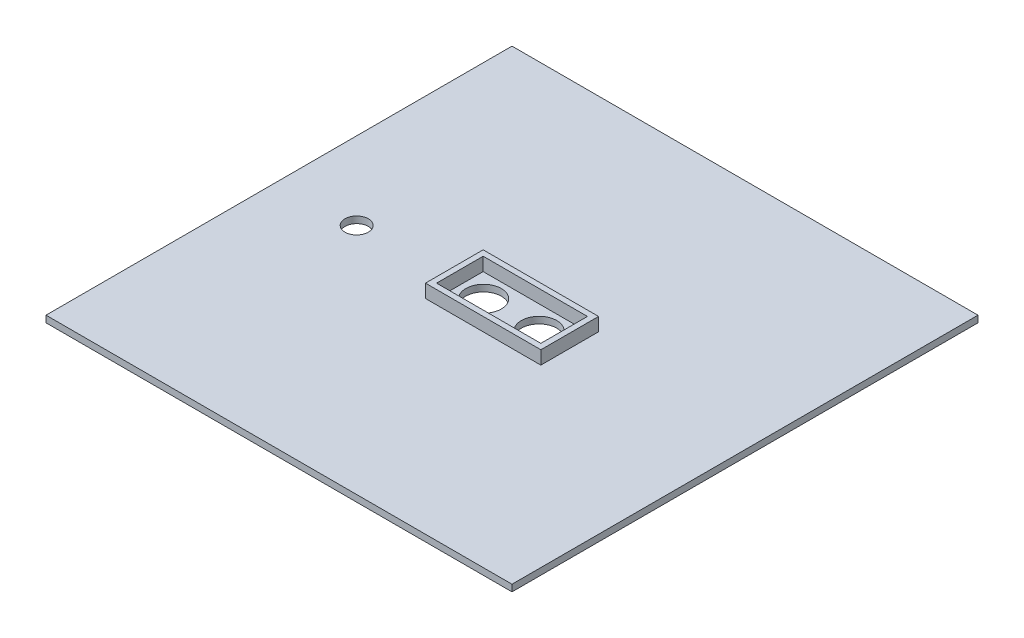
from build123d import *

# Parameters (mm, degrees)
SKETCH1_W           = 210
SKETCH1_H           = 210
BOSS_EXTRUDE1_DEPTH = 3
SKETCH2_W           = 199
SKETCH2_H           = 199
SKETCH2_W_2         = 193
SKETCH2_H_2         = 193
BOSS_EXTRUDE2_DEPTH = 5
SKETCH3_R           = 8
CUT_EXTRUDE1_DEPTH  = 149.707767114
SKETCH5_W           = 52
SKETCH5_H           = 26
SKETCH5_W_2         = 47
SKETCH5_H_2         = 21
BOSS_EXTRUDE4_DEPTH = 6
SKETCH8_W           = 10
SKETCH8_H           = 4
CUT_EXTRUDE2_DEPTH  = 149.707767114
SKETCH9_R           = 5.25
CUT_EXTRUDE3_DEPTH  = 149.707767114


with BuildPart() as part:
    # Sketch1 → Boss-Extrude1 (new body)
    with BuildSketch(Plane(origin=(0, 0, 0), x_dir=(1, 0, 0), z_dir=(0, 1, 0))):
        Rectangle(SKETCH1_W, SKETCH1_H)
    extrude(amount=BOSS_EXTRUDE1_DEPTH)

    # Sketch2 → Boss-Extrude2 (add)
    with BuildSketch(Plane.XZ):
        Rectangle(SKETCH2_W, SKETCH2_H)
        Rectangle(SKETCH2_W_2, SKETCH2_H_2, mode=Mode.SUBTRACT)
    extrude(amount=BOSS_EXTRUDE2_DEPTH)

    # Sketch3 → Cut-Extrude1 (cut, through all)
    with BuildSketch(Plane(origin=(0, 3, 0), x_dir=(1, 0, 0), z_dir=(0, 1, 0))):
        with Locations(Location((-12.805289864, 0, 0), (0, 0, 270))):
            Circle(SKETCH3_R)
        with Locations(Location((12.194710136, 0, 0), (0, 0, 270))):
            Circle(SKETCH3_R)
    extrude(amount=-CUT_EXTRUDE1_DEPTH, mode=Mode.SUBTRACT)

    # Sketch5 → Boss-Extrude4 (add)
    with BuildSketch(Plane(origin=(0, 3, 0), x_dir=(1, 0, 0), z_dir=(0, 1, 0))):
        Rectangle(SKETCH5_W, SKETCH5_H)
        Rectangle(SKETCH5_W_2, SKETCH5_H_2, mode=Mode.SUBTRACT)
    extrude(amount=BOSS_EXTRUDE4_DEPTH)

    # Sketch8 → Cut-Extrude2 (cut, through all)
    with BuildSketch(Plane(origin=(0, 3, 0), x_dir=(1, 0, 0), z_dir=(0, 1, 0))):
        with Locations((0, 17)):
            Rectangle(SKETCH8_W, SKETCH8_H)
    extrude(amount=-CUT_EXTRUDE2_DEPTH, mode=Mode.SUBTRACT)

    # Sketch9 → Cut-Extrude3 (cut, through all)
    with BuildSketch(Plane(origin=(0, 3, 0), x_dir=(1, 0, 0), z_dir=(0, 1, 0))):
        with Locations(Location((-70, 0, 0), (0, 0, 270))):
            Circle(SKETCH9_R)
    extrude(amount=-CUT_EXTRUDE3_DEPTH, mode=Mode.SUBTRACT)


solid = part.part
